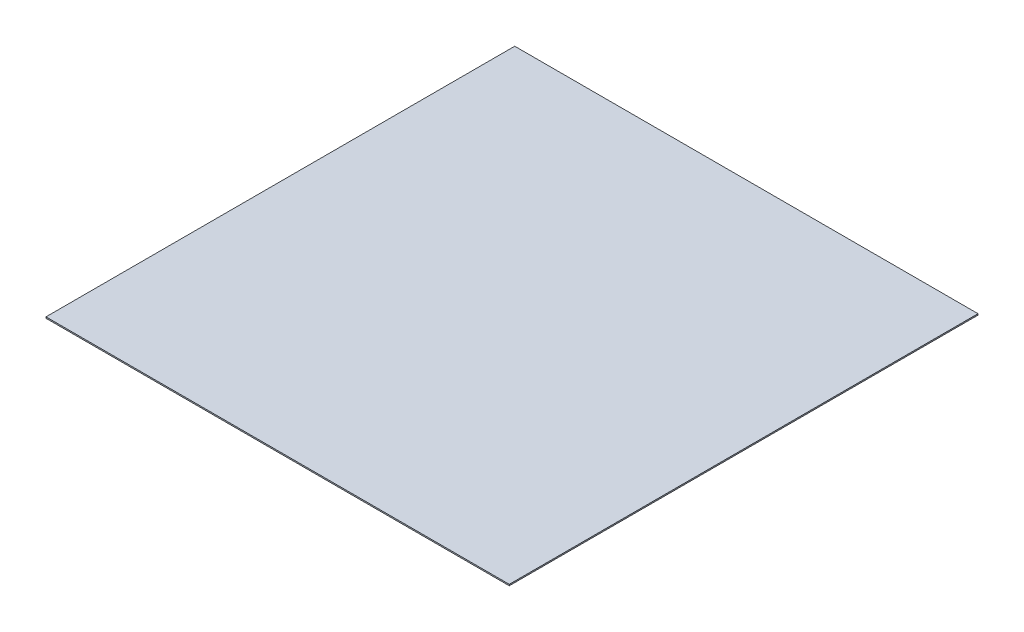
from build123d import *

# Parameters (mm, degrees)
SKETCH1_W           = 1790
SKETCH1_H           = 1811.1
BOSS_EXTRUDE1_DEPTH = 5


with BuildPart() as part:
    # Sketch1 → Boss-Extrude1 (new body)
    with BuildSketch(Plane(origin=(0, 0, 0), x_dir=(1, 0, 0), z_dir=(0, 1, 0))):
        Rectangle(SKETCH1_W, SKETCH1_H)
    extrude(amount=BOSS_EXTRUDE1_DEPTH)


solid = part.part
